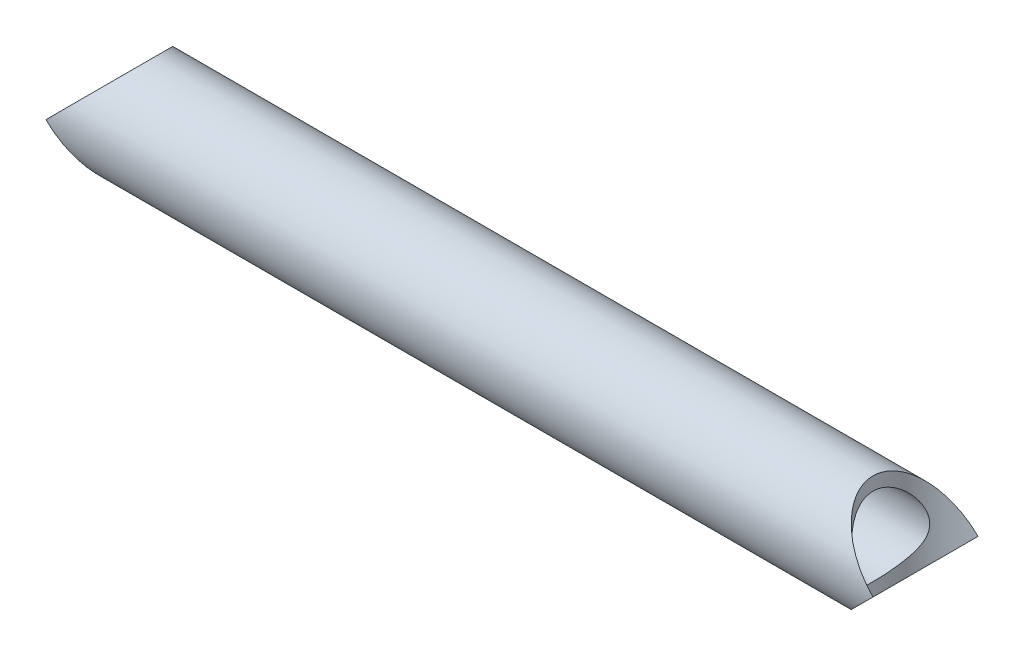
from build123d import *

# Parameters (mm, degrees)
SKETCH1_R               = 9.525
SKETCH1_R_2             = 7.112
BOSS_EXTRUDE1_DEPTH     = 150
CUT_EXTRUDE1_DEPTH      = 25
CUT_EXTRUDE1_DEPTH_BACK = 25
SKETCH2_R               = 9.525


with BuildPart() as part:
    # Sketch1 → Boss-Extrude1 (new body)
    with BuildSketch(Plane(origin=(0, 0, 0), x_dir=(0, 0, -1), z_dir=(1, 0, 0))):
        Circle(SKETCH1_R)
        Circle(SKETCH1_R_2, mode=Mode.SUBTRACT)
    extrude(amount=BOSS_EXTRUDE1_DEPTH)

    # Sketch2 → Cut-Extrude1 (cut, two sides: drawn at the far end of the back side and taken through both)
    with BuildSketch(Plane(origin=(0, 0, 0), x_dir=(1, 0, 0), z_dir=(0, 1, 0)).offset(-CUT_EXTRUDE1_DEPTH_BACK)):
        Circle(SKETCH2_R)
        with Locations((150, 0)):
            Circle(SKETCH2_R)
    extrude(amount=CUT_EXTRUDE1_DEPTH + CUT_EXTRUDE1_DEPTH_BACK, mode=Mode.SUBTRACT)


solid = part.part
